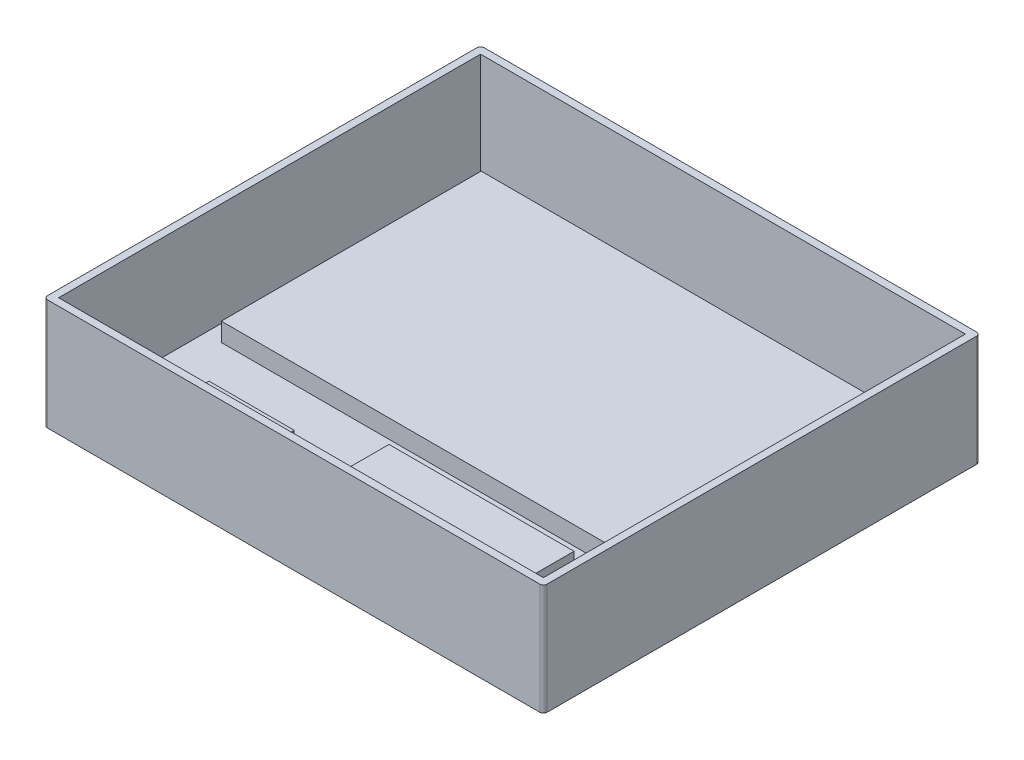
from build123d import *

# Parameters (mm, degrees)
SKETCH3_W           = 135
SKETCH3_H           = 118
BOSS_EXTRUDE1_DEPTH = 30
SKETCH4_W           = 131
SKETCH4_H           = 114
CUT_EXTRUDE1_DEPTH  = 28
SKETCH6_W           = 121
SKETCH6_H           = 70.2
SKETCH6_W_2         = 23
SKETCH6_H_2         = 11
SKETCH6_W_3         = 50
SKETCH6_H_3         = 30
BOSS_EXTRUDE2_DEPTH = 5
FILLET1_R           = 1
FILLET2_R           = 1
FILLET3_R           = 1
FILLET4_R           = 1


with BuildPart() as part:
    # Sketch3 → Boss-Extrude1 (new body)
    with BuildSketch(Plane(origin=(0, 0, 0), x_dir=(1, 0, 0), z_dir=(0, 1, 0))):
        Rectangle(SKETCH3_W, SKETCH3_H)
    extrude(amount=BOSS_EXTRUDE1_DEPTH)

    # Sketch4 → Cut-Extrude1 (cut)
    with BuildSketch(Plane(origin=(0, 30, 0), x_dir=(1, 0, 0), z_dir=(0, 1, 0))):
        Rectangle(SKETCH4_W, SKETCH4_H)
    extrude(amount=-CUT_EXTRUDE1_DEPTH, mode=Mode.SUBTRACT)

    # Sketch6 → Boss-Extrude2 (add)
    with BuildSketch(Plane(origin=(0, 2, 0), x_dir=(1, 0, 0), z_dir=(0, 1, 0))):
        with Locations((-0.543145458, 17.603777785)):
            Rectangle(SKETCH6_W, SKETCH6_H)
        with Locations((-37.163103621, -38.689582539)):
            Rectangle(SKETCH6_W_2, SKETCH6_H_2)
        with Locations((15.455951062, -38.689582539)):
            Rectangle(SKETCH6_W_3, SKETCH6_H_3)
    extrude(amount=BOSS_EXTRUDE2_DEPTH)

    # Fillet1
    fillet1_edges = [part.edges().sort_by_distance(p)[0] for p in [
        (-67.5, 15, 59),
    ]]
    fillet(fillet1_edges, radius=FILLET1_R)

    # Fillet2
    fillet2_edges = [part.edges().sort_by_distance(p)[0] for p in [
        (67.5, 15, 59),
    ]]
    fillet(fillet2_edges, radius=FILLET2_R)

    # Fillet3
    fillet3_edges = [part.edges().sort_by_distance(p)[0] for p in [
        (67.5, 15, -59),
    ]]
    fillet(fillet3_edges, radius=FILLET3_R)

    # Fillet4
    fillet4_edges = [part.edges().sort_by_distance(p)[0] for p in [
        (-67.5, 15, -59),
    ]]
    fillet(fillet4_edges, radius=FILLET4_R)


solid = part.part
